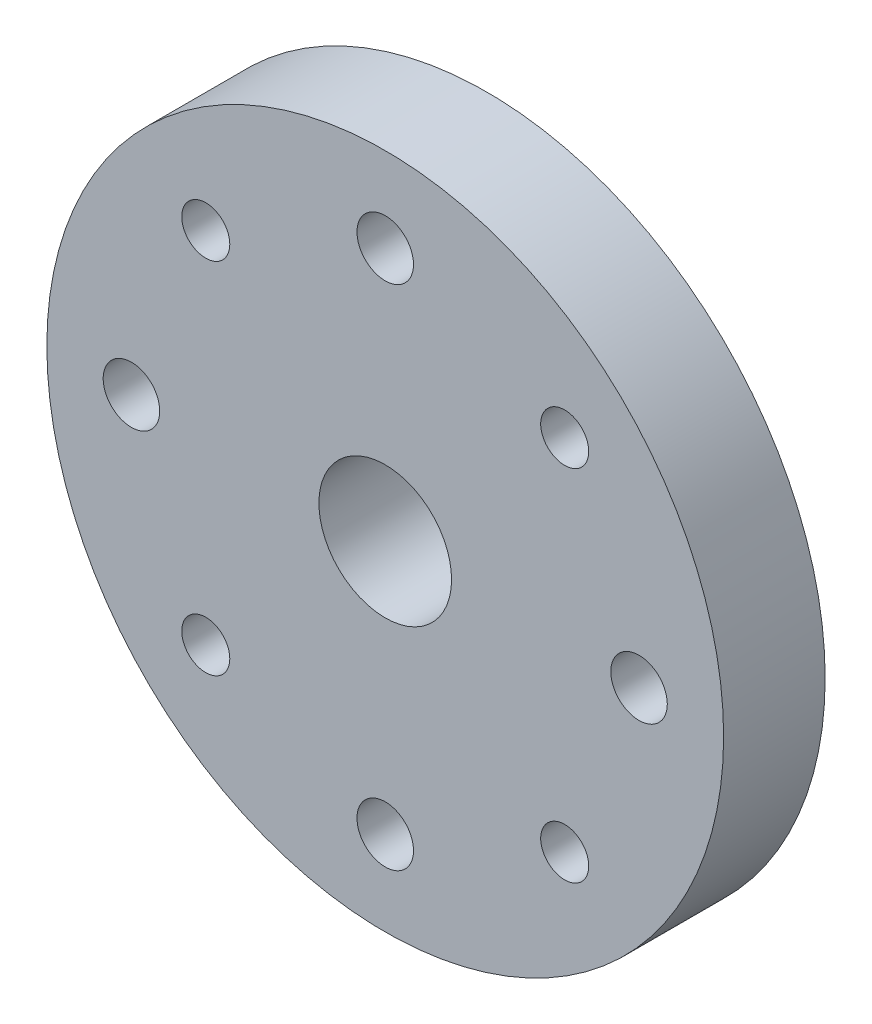
from build123d import *

# Parameters (mm, degrees)
SKETCH1_R           = 20
SKETCH1_R_2         = 4
SKETCH1_R_3         = 1.75
SKETCH1_R_4         = 1.5
BOSS_EXTRUDE1_DEPTH = 6
MOVE_FACE2_BY       = 0.08
MOVE_FACE2_2_BY     = 0.08
MOVE_FACE2_3_BY     = 0.08
MOVE_FACE2_4_BY     = 0.08
MOVE_FACE2_5_BY     = 0.08
MOVE_FACE2_6_BY     = 0.08
MOVE_FACE2_7_BY     = 0.08
MOVE_FACE2_8_BY     = 0.08
MOVE_FACE2_9_BY     = 0.08


with BuildPart() as part:
    # Sketch1 → Boss-Extrude1 (new body)
    with BuildSketch(Plane.XY):
        Circle(SKETCH1_R)
        Circle(SKETCH1_R_2, mode=Mode.SUBTRACT)
        with Locations((0, 15)):
            Circle(SKETCH1_R_3, mode=Mode.SUBTRACT)
        with Locations((10.606601718, 10.606601718)):
            Circle(SKETCH1_R_4, mode=Mode.SUBTRACT)
        with Locations((15, 0)):
            Circle(SKETCH1_R_3, mode=Mode.SUBTRACT)
        with Locations((10.606601718, -10.606601718)):
            Circle(SKETCH1_R_4, mode=Mode.SUBTRACT)
        with Locations((0, -15)):
            Circle(SKETCH1_R_3, mode=Mode.SUBTRACT)
        with Locations((-10.606601718, -10.606601718)):
            Circle(SKETCH1_R_4, mode=Mode.SUBTRACT)
        with Locations((-15, 0)):
            Circle(SKETCH1_R_3, mode=Mode.SUBTRACT)
        with Locations((-10.606601718, 10.606601718)):
            Circle(SKETCH1_R_4, mode=Mode.SUBTRACT)
    extrude(amount=BOSS_EXTRUDE1_DEPTH)

    # Move Face2: a curved face moved outward by 0.08
    add(Solid.thicken(part.faces().sort_by_distance((-4, 0, 3))[0], MOVE_FACE2_BY))

    # Move Face2 2: a curved face moved outward by 0.08
    add(Solid.thicken(part.faces().sort_by_distance((-1.75, 15, 3))[0], MOVE_FACE2_2_BY))

    # Move Face2 3: a curved face moved outward by 0.08
    add(Solid.thicken(part.faces().sort_by_distance((9.106601718, 10.606601718, 3))[0], MOVE_FACE2_3_BY))

    # Move Face2 4: a curved face moved outward by 0.08
    add(Solid.thicken(part.faces().sort_by_distance((13.25, 0, 3))[0], MOVE_FACE2_4_BY))

    # Move Face2 5: a curved face moved outward by 0.08
    add(Solid.thicken(part.faces().sort_by_distance((9.106601718, -10.606601718, 3))[0], MOVE_FACE2_5_BY))

    # Move Face2 6: a curved face moved outward by 0.08
    add(Solid.thicken(part.faces().sort_by_distance((-1.75, -15, 3))[0], MOVE_FACE2_6_BY))

    # Move Face2 7: a curved face moved outward by 0.08
    add(Solid.thicken(part.faces().sort_by_distance((-12.106601718, -10.606601718, 3))[0], MOVE_FACE2_7_BY))

    # Move Face2 8: a curved face moved outward by 0.08
    add(Solid.thicken(part.faces().sort_by_distance((-16.75, 0, 3))[0], MOVE_FACE2_8_BY))

    # Move Face2 9: a curved face moved outward by 0.08
    add(Solid.thicken(part.faces().sort_by_distance((-12.106601718, 10.606601718, 3))[0], MOVE_FACE2_9_BY))


solid = part.part
